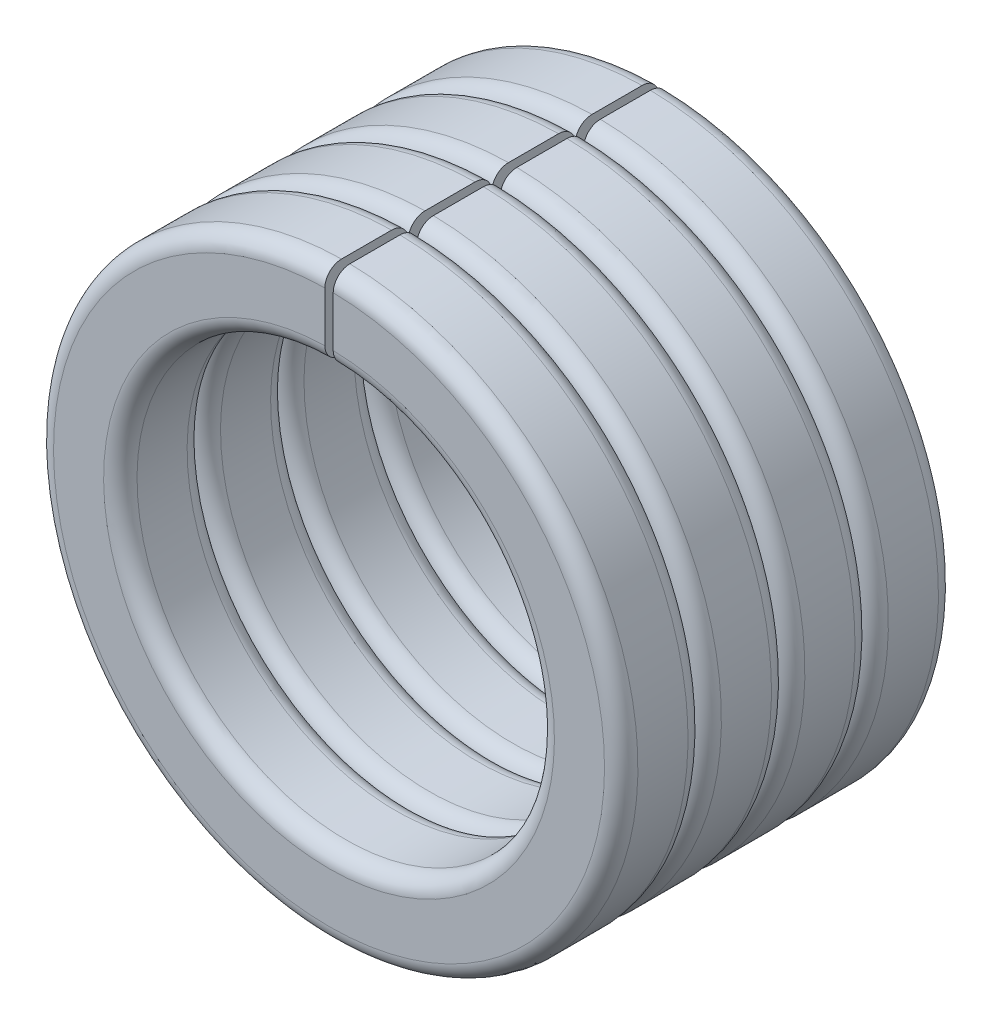
from build123d import *

# Parameters (mm, degrees)
SKETCH3_W          = 1
SKETCH3_H          = 76.137854622
CUT_EXTRUDE1_DEPTH = 20
LPATTERN1_COUNT    = 4
LPATTERN1_PITCH    = 10


with BuildPart() as part:
    # Sketch2 → Revolve1 (revolve)
    with BuildSketch(Plane(origin=(0, 0, 0), x_dir=(1, 0, 0), z_dir=(0, 1, 0)), mode=Mode.PRIVATE) as revolve1_sk:
        with BuildLine():
            Line((-27, 5.7), (-33, 5.7))
            ThreePointArc((-33, 5.7), (-34.414213562, 6.285786438), (-35, 7.7))
            Line((-35, 7.7), (-35, 13.7))
            ThreePointArc((-35, 13.7), (-34.414213562, 15.114213562), (-33, 15.7))
            Line((-33, 15.7), (-27, 15.7))
            ThreePointArc((-27, 15.7), (-25.585786438, 15.114213562), (-25, 13.7))
            Line((-25, 13.7), (-25, 7.7))
            ThreePointArc((-25, 7.7), (-25.585786438, 6.285786438), (-27, 5.7))
        make_face()
    revolve(revolve1_sk.sketch.rotate(Axis((0, 0, 0), (0, 0, -1)), 180), axis=Axis((0, 0, 0), (0, 0, -1)))

    # Sketch3 → Cut-Extrude1 (cut)
    with BuildSketch(Plane.XY.offset(-5.7)):
        with Locations((0, 37.124385567)):
            Rectangle(SKETCH3_W, SKETCH3_H)
    extrude(amount=-CUT_EXTRUDE1_DEPTH, mode=Mode.SUBTRACT)


with BuildPart() as lpattern1_1:
    # LPattern1: pattern copy
    add(part.part.moved(Location(Vector(0, 0, -1) * (1 * LPATTERN1_PITCH))))


with BuildPart() as lpattern1_2:
    # LPattern1: pattern copy
    add(part.part.moved(Location(Vector(0, 0, -1) * (2 * LPATTERN1_PITCH))))


with BuildPart() as lpattern1_3:
    # LPattern1: pattern copy
    add(part.part.moved(Location(Vector(0, 0, -1) * (3 * LPATTERN1_PITCH))))


solid = Compound([part.part, lpattern1_1.part, lpattern1_2.part, lpattern1_3.part])
